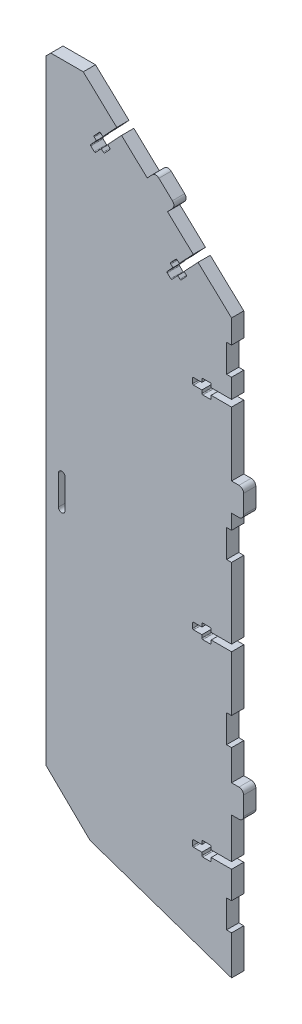
from build123d import *

# Parameters (mm, degrees)
BOSS_EXTRUDE1_DEPTH = 6.6


with BuildPart() as part:
    # Model → Boss-Extrude1 (new body)
    with BuildSketch(Plane.XY):
        with BuildLine():
            Line((-2.7, 21.1), (0, 21.1))
            Line((0, 21.1), (0, 0))
            Line((0, 0), (-76.35, 26.1117))
            Line((-76.35, 26.1117), (-100, 49.2))
            Line((-100, 49.2), (-100, 380.9))
            Line((-100, 380.9), (-97.5, 383.4))
            Line((-97.5, 383.4), (-80, 383.4))
            Line((-80, 383.4), (-61.92031318, 366.450293606))
            Line((-61.92031318, 366.450293606), (-69.443665597, 358.42538436))
            Line((-69.443665597, 358.42538436), (-70.599982066, 359.50943105))
            ThreePointArc((-70.599982066, 359.50943105), (-70.958073277, 359.644402505), (-71.306721232, 359.486633012))
            Line((-71.306721232, 359.486633012), (-74.042485748, 356.568484196))
            ThreePointArc((-74.042485748, 356.568484196), (-74.177457203, 356.210392984), (-74.01968771, 355.861745029))
            Line((-74.01968771, 355.861745029), (-72.863371242, 354.77769834))
            Line((-72.863371242, 354.77769834), (-75.941106322, 351.494780921))
            ThreePointArc((-75.941106322, 351.494780921), (-76.076077777, 351.13668971), (-75.918308284, 350.788041755))
            Line((-75.918308284, 350.788041755), (-74.057988413, 349.043991876))
            ThreePointArc((-74.057988413, 349.043991876), (-73.699897202, 348.909020421), (-73.351249247, 349.066789913))
            Line((-73.351249247, 349.066789913), (-70.273514167, 352.349707332))
            Line((-70.273514167, 352.349707332), (-69.117197698, 351.265660643))
            ThreePointArc((-69.117197698, 351.265660643), (-68.759106487, 351.130689188), (-68.410458532, 351.288458681))
            Line((-68.410458532, 351.288458681), (-65.674694016, 354.206607497))
            ThreePointArc((-65.674694016, 354.206607497), (-65.539722561, 354.564698709), (-65.697492054, 354.913346664))
            Line((-65.697492054, 354.913346664), (-66.853808523, 355.997393353))
            Line((-66.853808523, 355.997393353), (-59.330456105, 364.022302598))
            Line((-59.330456105, 364.022302598), (-45.469249226, 351.02742115))
            Line((-45.469249226, 351.02742115), (-42.733484711, 353.945569966))
            ThreePointArc((-42.733484711, 353.945569966), (-40.990244935, 354.73441743), (-39.199788878, 354.059560154))
            Line((-39.199788878, 354.059560154), (-31.904416837, 347.220148866))
            ThreePointArc((-31.904416837, 347.220148866), (-31.115569373, 345.47690909), (-31.790426649, 343.686453033))
            Line((-31.790426649, 343.686453033), (-34.526191164, 340.768304216))
            Line((-34.526191164, 340.768304216), (-20.664984286, 327.773422768))
            Line((-20.664984286, 327.773422768), (-28.188336703, 319.748513522))
            Line((-28.188336703, 319.748513522), (-29.344653172, 320.832560211))
            ThreePointArc((-29.344653172, 320.832560211), (-29.702744383, 320.967531667), (-30.051392338, 320.809762174))
            Line((-30.051392338, 320.809762174), (-32.787156854, 317.891613357))
            ThreePointArc((-32.787156854, 317.891613357), (-32.922128309, 317.533522146), (-32.764358816, 317.184874191))
            Line((-32.764358816, 317.184874191), (-31.608042348, 316.100827502))
            Line((-31.608042348, 316.100827502), (-34.685777428, 312.817910083))
            ThreePointArc((-34.685777428, 312.817910083), (-34.820748883, 312.459818871), (-34.66297939, 312.111170916))
            Line((-34.66297939, 312.111170916), (-32.802659519, 310.367121038))
            ThreePointArc((-32.802659519, 310.367121038), (-32.444568308, 310.232149583), (-32.095920353, 310.389919075))
            Line((-32.095920353, 310.389919075), (-29.018185273, 313.672836494))
            Line((-29.018185273, 313.672836494), (-27.861868804, 312.588789805))
            ThreePointArc((-27.861868804, 312.588789805), (-27.503777593, 312.45381835), (-27.155129638, 312.611587842))
            Line((-27.155129638, 312.611587842), (-24.419365122, 315.529736659))
            ThreePointArc((-24.419365122, 315.529736659), (-24.284393667, 315.88782787), (-24.44216316, 316.236475825))
            Line((-24.44216316, 316.236475825), (-25.598479629, 317.320522515))
            Line((-25.598479629, 317.320522515), (-18.075127211, 325.34543176))
            Line((-18.075127211, 325.34543176), (0, 308.4))
            Line((0, 308.4), (0, 295.7))
            Line((0, 295.7), (-2.7, 295.7))
            Line((-2.7, 295.7), (-2.7, 280.7))
            Line((-2.7, 280.7), (0, 280.7))
            Line((0, 280.7), (0, 270.3))
            Line((0, 270.3), (-11, 270.3))
            Line((-11, 270.3), (-11, 271.885))
            ThreePointArc((-11, 271.885), (-11.146446609, 272.238553391), (-11.5, 272.385))
            Line((-11.5, 272.385), (-15.5, 272.385))
            ThreePointArc((-15.5, 272.385), (-15.853553391, 272.238553391), (-16, 271.885))
            Line((-16, 271.885), (-16, 270.3))
            Line((-16, 270.3), (-20.5, 270.3))
            ThreePointArc((-20.5, 270.3), (-20.853553391, 270.153553391), (-21, 269.8))
            Line((-21, 269.8), (-21, 267.25))
            ThreePointArc((-21, 267.25), (-20.853553391, 266.896446609), (-20.5, 266.75))
            Line((-20.5, 266.75), (-16, 266.75))
            Line((-16, 266.75), (-16, 265.165))
            ThreePointArc((-16, 265.165), (-15.853553391, 264.811446609), (-15.5, 264.665))
            Line((-15.5, 264.665), (-11.5, 264.665))
            ThreePointArc((-11.5, 264.665), (-11.146446609, 264.811446609), (-11, 265.165))
            Line((-11, 265.165), (-11, 266.75))
            Line((-11, 266.75), (0, 266.75))
            Line((0, 266.75), (0, 232.2))
            Line((0, 232.2), (4, 232.2))
            ThreePointArc((4, 232.2), (5.767766953, 231.467766953), (6.5, 229.7))
            Line((6.5, 229.7), (6.5, 219.7))
            ThreePointArc((6.5, 219.7), (5.767766953, 217.932233047), (4, 217.2))
            Line((4, 217.2), (0, 217.2))
            Line((0, 217.2), (0, 209.166666667))
            Line((0, 209.166666667), (-2.7, 209.166666667))
            Line((-2.7, 209.166666667), (-2.7, 194.166666667))
            Line((-2.7, 194.166666667), (0, 194.166666667))
            Line((0, 194.166666667), (0, 155.975))
            Line((0, 155.975), (-11, 155.975))
            Line((-11, 155.975), (-11, 157.56))
            ThreePointArc((-11, 157.56), (-11.146446609, 157.913553391), (-11.5, 158.06))
            Line((-11.5, 158.06), (-15.5, 158.06))
            ThreePointArc((-15.5, 158.06), (-15.853553391, 157.913553391), (-16, 157.56))
            Line((-16, 157.56), (-16, 155.975))
            Line((-16, 155.975), (-20.5, 155.975))
            ThreePointArc((-20.5, 155.975), (-20.853553391, 155.828553391), (-21, 155.475))
            Line((-21, 155.475), (-21, 152.925))
            ThreePointArc((-21, 152.925), (-20.853553391, 152.571446609), (-20.5, 152.425))
            Line((-20.5, 152.425), (-16, 152.425))
            Line((-16, 152.425), (-16, 150.84))
            ThreePointArc((-16, 150.84), (-15.853553391, 150.486446609), (-15.5, 150.34))
            Line((-15.5, 150.34), (-11.5, 150.34))
            ThreePointArc((-11.5, 150.34), (-11.146446609, 150.486446609), (-11, 150.84))
            Line((-11, 150.84), (-11, 152.425))
            Line((-11, 152.425), (0, 152.425))
            Line((0, 152.425), (0, 122.633333333))
            Line((0, 122.633333333), (-2.7, 122.633333333))
            Line((-2.7, 122.633333333), (-2.7, 107.633333333))
            Line((-2.7, 107.633333333), (0, 107.633333333))
            Line((0, 107.633333333), (0, 91.2))
            Line((0, 91.2), (4, 91.2))
            ThreePointArc((4, 91.2), (5.767766953, 90.467766953), (6.5, 88.7))
            Line((6.5, 88.7), (6.5, 78.7))
            ThreePointArc((6.5, 78.7), (5.767766953, 76.932233047), (4, 76.2))
            Line((4, 76.2), (0, 76.2))
            Line((0, 76.2), (0, 54.35))
            Line((0, 54.35), (-11, 54.35))
            Line((-11, 54.35), (-11, 55.935))
            ThreePointArc((-11, 55.935), (-11.146446609, 56.288553391), (-11.5, 56.435))
            Line((-11.5, 56.435), (-15.5, 56.435))
            ThreePointArc((-15.5, 56.435), (-15.853553391, 56.288553391), (-16, 55.935))
            Line((-16, 55.935), (-16, 54.35))
            Line((-16, 54.35), (-20.5, 54.35))
            ThreePointArc((-20.5, 54.35), (-20.853553391, 54.203553391), (-21, 53.85))
            Line((-21, 53.85), (-21, 51.3))
            ThreePointArc((-21, 51.3), (-20.853553391, 50.946446609), (-20.5, 50.8))
            Line((-20.5, 50.8), (-16, 50.8))
            Line((-16, 50.8), (-16, 49.215))
            ThreePointArc((-16, 49.215), (-15.853553391, 48.861446609), (-15.5, 48.715))
            Line((-15.5, 48.715), (-11.5, 48.715))
            ThreePointArc((-11.5, 48.715), (-11.146446609, 48.861446609), (-11, 49.215))
            Line((-11, 49.215), (-11, 50.8))
            Line((-11, 50.8), (0, 50.8))
            Line((0, 50.8), (0, 36.1))
            Line((0, 36.1), (-2.7, 36.1))
            Line((-2.7, 36.1), (-2.7, 21.1))
        make_face()
        with BuildLine():
            Line((-89.8155254, 173.347348004), (-89.86349893, 172.952628674))
            Line((-89.86349893, 172.952628674), (-90.006760381, 172.584057561))
            ThreePointArc((-90.006760381, 172.584057561), (-92.000532075, 171.616009494), (-93.384262393, 173.347348004))
            Line((-93.384262393, 173.347348004), (-93.384262393, 189.222348004))
            ThreePointArc((-93.384262393, 189.222348004), (-92.000532075, 190.953686513), (-90.006760381, 189.985638446))
            Line((-90.006760381, 189.985638446), (-89.864204346, 189.619898255))
            Line((-89.864204346, 189.619898255), (-89.8155254, 189.222348004))
            Line((-89.8155254, 189.222348004), (-89.8155254, 173.347348004))
        make_face(mode=Mode.SUBTRACT)
    extrude(amount=BOSS_EXTRUDE1_DEPTH)


solid = part.part
